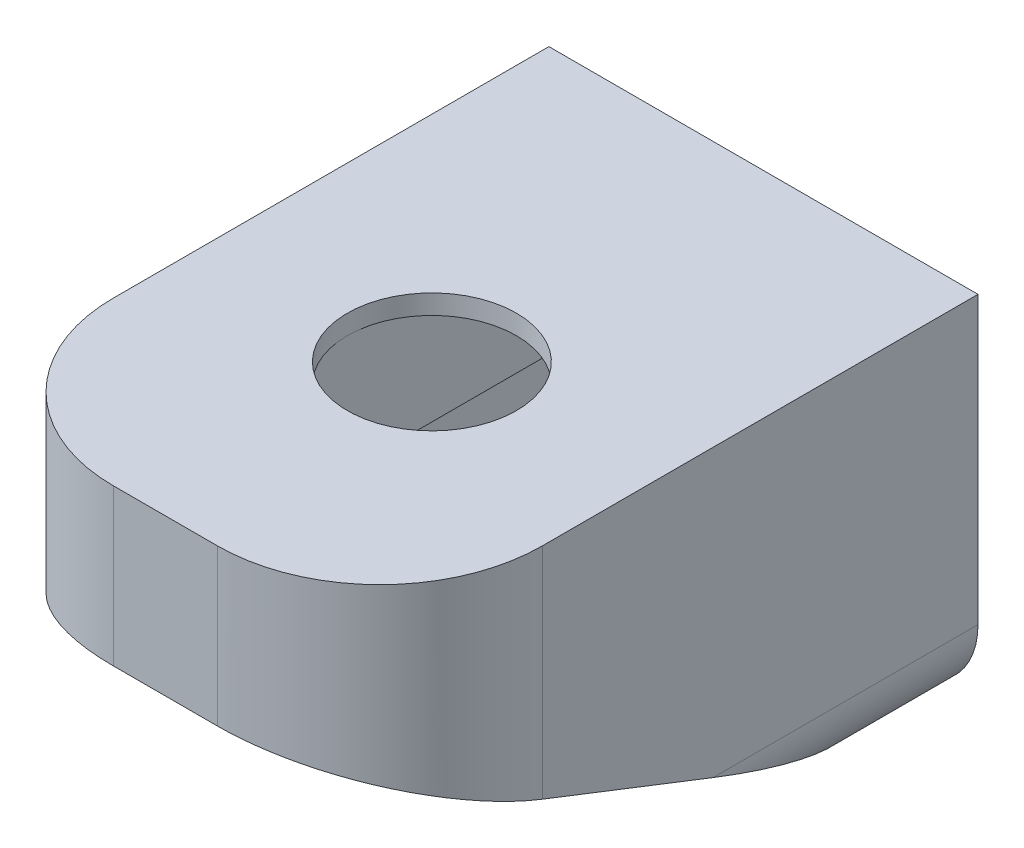
from build123d import *

# Parameters (mm, degrees)
SKETCH2_W           = 33
SKETCH2_H           = 28
BOSS_EXTRUDE1_DEPTH = 46
CUT_EXTRUDE2_DEPTH  = 59.318093247
CUT_EXTRUDE4_START  = -3
CUT_EXTRUDE4_DEPTH  = 27
FILLET2_R           = 12.5
FILLET3_R           = 12.5
FILLET4_R           = 6
SKETCH7_W           = 13
SKETCH7_H           = 23
CUT_EXTRUDE5_DEPTH  = 9
SKETCH8_R           = 6.5
CUT_EXTRUDE6_DEPTH  = 9
SKETCH9_R           = 1
CUT_EXTRUDE7_DEPTH  = 9
SKETCH10_R          = 2.5
SKETCH10_R_2        = 1.3
CUT_EXTRUDE8_DEPTH  = 9


with BuildPart() as part:
    # Sketch2 → Boss-Extrude1 (new body)
    with BuildSketch(Plane.XY):
        Rectangle(SKETCH2_W, SKETCH2_H)
    extrude(amount=BOSS_EXTRUDE1_DEPTH)

    # Sketch5 → Cut-Extrude2 (cut, through all)
    with BuildSketch(Plane(origin=(16.5, 0, 0), x_dir=(0, 0, -1), z_dir=(1, 0, 0))):
        Polygon((-5, -14), (-46, 2), (-46, -14), align=None)
    extrude(amount=-CUT_EXTRUDE2_DEPTH, mode=Mode.SUBTRACT)

    # Sketch6 → Cut-Extrude4 (cut)
    with BuildSketch(Plane(origin=(16.5, 0, 0), x_dir=(0, 0, -1), z_dir=(1, 0, 0)).offset(CUT_EXTRUDE4_START)):
        Polygon((-5, -14), (-2.5, -14), (-2.5, 3.5), (-40.5, 3.5), (-40.5, -0.146341463), align=None)
    extrude(amount=-CUT_EXTRUDE4_DEPTH, mode=Mode.SUBTRACT)

    # Fillet2
    fillet2_edges = [part.edges().sort_by_distance(p)[0] for p in [
        (-13.5, 1.676829268, 40.5),
        (13.5, 1.676829268, 40.5),
    ]]
    fillet(fillet2_edges, radius=FILLET2_R)

    # Fillet3
    fillet3_edges = [part.edges().sort_by_distance(p)[0] for p in [
        (16.5, 8, 46),
        (-16.5, 8, 46),
    ]]
    fillet(fillet3_edges, radius=FILLET3_R)

    # Fillet4
    fillet4_edges = [part.edges().sort_by_distance(p)[0] for p in [
        (-16.5, -14, 2.5),
        (16.5, -14, 2.5),
    ]]
    fillet(fillet4_edges, radius=FILLET4_R)

    # Sketch7 → Cut-Extrude5 (cut)
    with BuildSketch(Plane.XZ.offset(-3.5)):
        with Locations((0, 20.5)):
            Rectangle(SKETCH7_W, SKETCH7_H)
    extrude(amount=-CUT_EXTRUDE5_DEPTH, mode=Mode.SUBTRACT)

    # Sketch8 → Cut-Extrude6 (cut)
    with BuildSketch(Plane.XZ.offset(-12.5)):
        with Locations((0, 25.5)):
            Circle(SKETCH8_R)
    extrude(amount=-CUT_EXTRUDE6_DEPTH, mode=Mode.SUBTRACT)

    # Sketch9 → Cut-Extrude7 (cut)
    with BuildSketch(Plane.XZ.offset(-3.5)):
        with Locations((0, 34.3)):
            Circle(SKETCH9_R)
        with Locations((0, 6.7)):
            Circle(SKETCH9_R)
    extrude(amount=-CUT_EXTRUDE7_DEPTH, mode=Mode.SUBTRACT)

    # Sketch10 → Cut-Extrude8 (cut)
    with BuildSketch(Plane(origin=(0, 0, 0), x_dir=(-1, 0, 0), z_dir=(0, 0, -1))):
        with Locations((-5, 0)):
            Circle(SKETCH10_R)
        with Locations((-0.5, 0)):
            Circle(SKETCH10_R_2)
        with Locations((-9.5, 0)):
            Circle(SKETCH10_R_2)
    extrude(amount=-CUT_EXTRUDE8_DEPTH, mode=Mode.SUBTRACT)


solid = part.part
